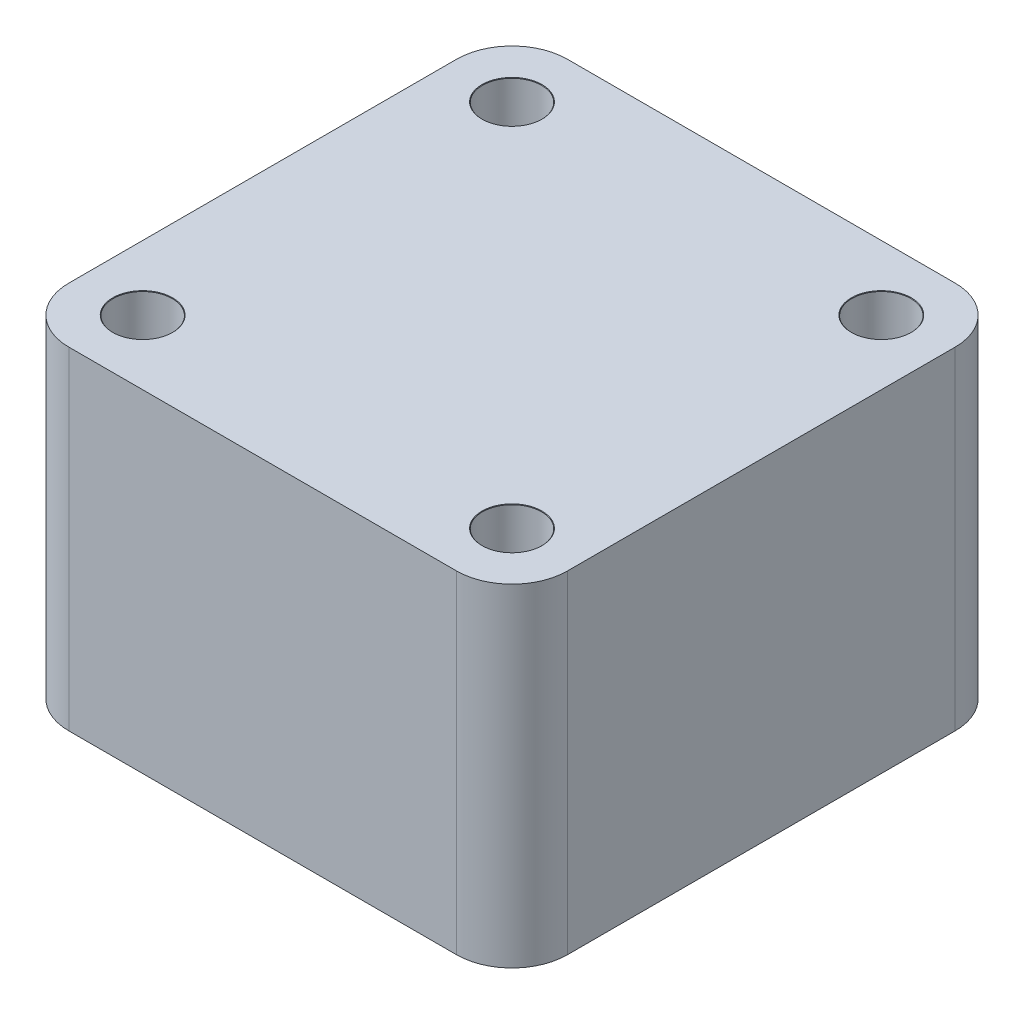
from build123d import *

# Parameters (mm, degrees)
SKETCH1_W                     = 27
SKETCH1_H                     = 27
BOSS_EXTRUDE1_DEPTH           = 18
M3_CLEARANCE_HOLE1_AT_2_COUNT = 2
M3_CLEARANCE_HOLE1_AT_2_PITCH = 20
M3_CLEARANCE_HOLE1_AT_3_COUNT = 2
M3_CLEARANCE_HOLE1_AT_3_PITCH = 28.284271247
M3_CLEARANCE_HOLE1_AT_4_COUNT = 2
M3_CLEARANCE_HOLE1_AT_4_PITCH = 20
FILLET1_R                     = 3


with BuildPart() as part:
    # Sketch1 → Boss-Extrude1 (new body)
    with BuildSketch(Plane(origin=(0, 0, 0), x_dir=(1, 0, 0), z_dir=(0, 1, 0))):
        Rectangle(SKETCH1_W, SKETCH1_H)
    extrude(amount=BOSS_EXTRUDE1_DEPTH)

    # Sketch4 → M3 Clearance Hole1 (revolve, cut)
    with BuildSketch(Plane(origin=(10, 0, -10), x_dir=(0, 0, -1), z_dir=(1, 0, 0))):
        Polygon((0, 0), (0, 18), (1.625, 18), (1.6, 17.975), (1.6, 0.025), (1.625, 0), align=None)
    m3_clearance_hole1 = revolve(axis=Axis((10, -6.35, -10), (0, 1, 0)), mode=Mode.SUBTRACT)

    # M3 Clearance Hole1 at 2: M3 Clearance Hole1 ×2
    with Locations(*[(-i * M3_CLEARANCE_HOLE1_AT_2_PITCH, 0, 0) for i in range(1, M3_CLEARANCE_HOLE1_AT_2_COUNT)]):
        add(m3_clearance_hole1, mode=Mode.SUBTRACT)

    # M3 Clearance Hole1 at 3: M3 Clearance Hole1 ×2
    with Locations(*[Vector(-0.7071067811865476, 0, 0.7071067811865475) * (i * M3_CLEARANCE_HOLE1_AT_3_PITCH) for i in range(1, M3_CLEARANCE_HOLE1_AT_3_COUNT)]):
        add(m3_clearance_hole1, mode=Mode.SUBTRACT)

    # M3 Clearance Hole1 at 4: M3 Clearance Hole1 ×2
    with Locations(*[(0, 0, i * M3_CLEARANCE_HOLE1_AT_4_PITCH) for i in range(1, M3_CLEARANCE_HOLE1_AT_4_COUNT)]):
        add(m3_clearance_hole1, mode=Mode.SUBTRACT)

    # Fillet1
    fillet1_edges = [part.edges().sort_by_distance(p)[0] for p in [
        (-13.5, 9, -13.5),
        (13.5, 9, -13.5),
        (13.5, 9, 13.5),
        (-13.5, 9, 13.5),
    ]]
    fillet(fillet1_edges, radius=FILLET1_R)


solid = part.part
